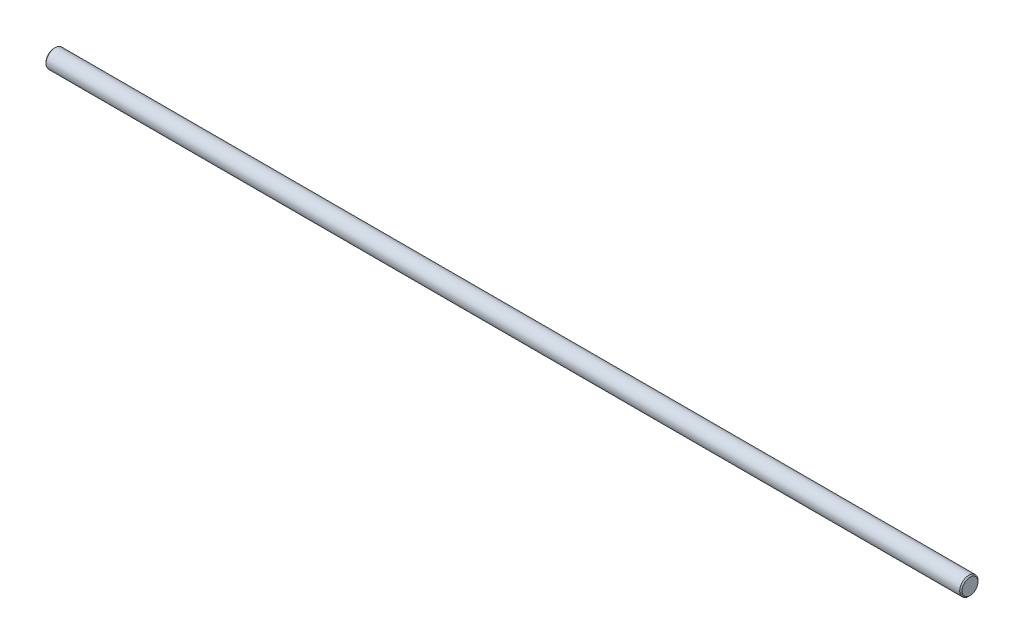
from build123d import *


with BuildPart() as part:
    # Sketch1 → Revolve1 (revolve)
    with BuildSketch(Plane.XY, mode=Mode.PRIVATE) as revolve1_sk:
        Polygon((0, 0), (0, 3.5), (0.5, 4), (399.5, 4), (400, 3.5), (400, 0), align=None)
    revolve(revolve1_sk.sketch.rotate(Axis((400, 0, 0), (-1, 0, 0)), 270), axis=Axis((400, 0, 0), (-1, 0, 0)))


solid = part.part
